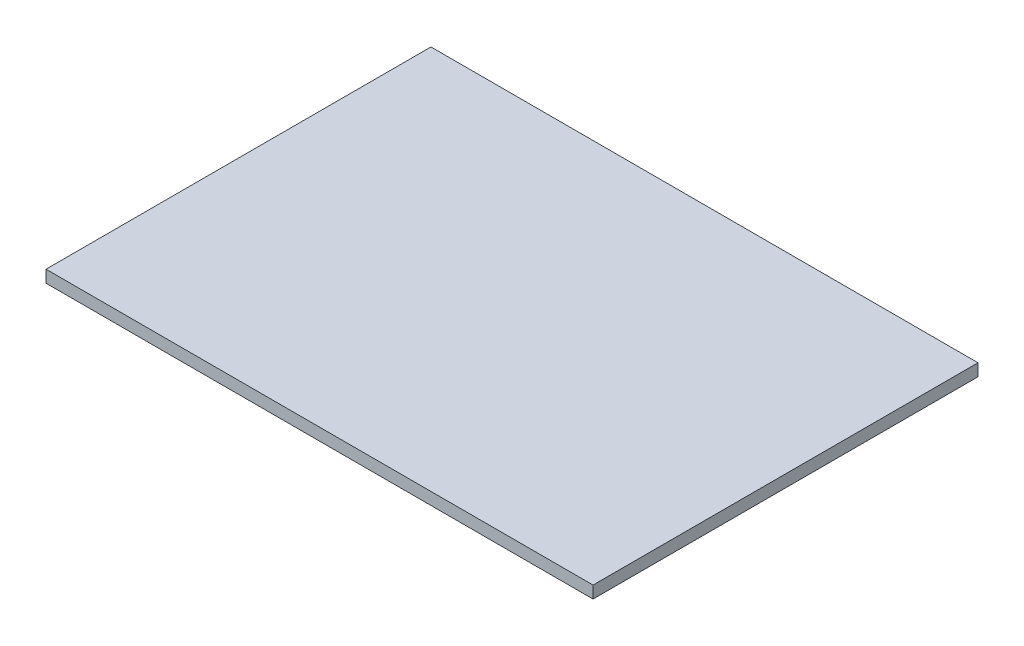
from build123d import *

# Parameters (mm, degrees)
SKETCH1_W           = 135
SKETCH1_H           = 95
BOSS_EXTRUDE1_DEPTH = 3


with BuildPart() as part:
    # Sketch1 → Boss-Extrude1 (new body)
    with BuildSketch(Plane(origin=(0, 0, 0), x_dir=(1, 0, 0), z_dir=(0, 1, 0))):
        Rectangle(SKETCH1_W, SKETCH1_H)
    extrude(amount=BOSS_EXTRUDE1_DEPTH)


solid = part.part
